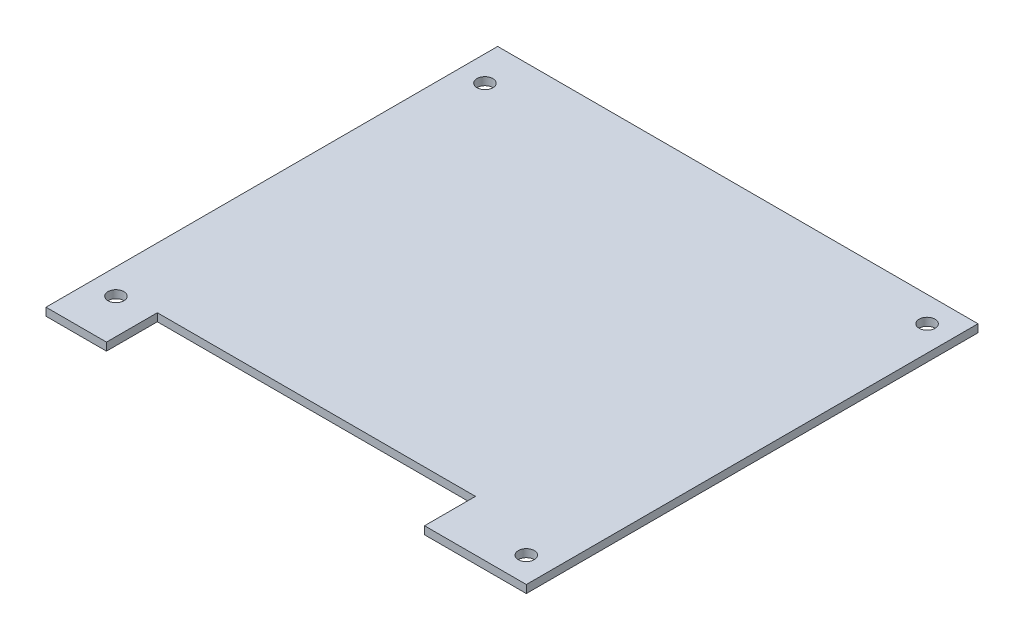
from build123d import *

# Parameters (mm, degrees)
BOSS_EXTRUDE1_DEPTH = 1.57
SKETCH2_R           = 1.59
CUT_EXTRUDE1_DEPTH  = 66.831946272


with BuildPart() as part:
    # Sketch1 → Boss-Extrude1 (new body)
    with BuildSketch(Plane(origin=(0, 0, 0), x_dir=(1, 0, 0), z_dir=(0, 1, 0))):
        Polygon((-35.875, -45.085), (-47.945, -45.085), (-47.945, 45.085), (47.945, 45.085), (47.945, -45.085), (27.625, -45.085), (27.625, -34.925), (-35.875, -34.925), align=None)
    extrude(amount=BOSS_EXTRUDE1_DEPTH)

    # Sketch2 → Cut-Extrude1 (cut, through all)
    with BuildSketch(Plane(origin=(0, 1.57, 0), x_dir=(1, 0, 0), z_dir=(0, 1, 0))):
        with Locations(Location((42.865, -40.005, 0), (0, 0, 270))):
            Circle(SKETCH2_R)
        with Locations(Location((-42.865, -36.195, 0), (0, 0, 270))):
            Circle(SKETCH2_R)
        with Locations(Location((-42.865, 37.465, 0), (0, 0, 270))):
            Circle(SKETCH2_R)
        with Locations(Location((42.865, 40.005, 0), (0, 0, 270))):
            Circle(SKETCH2_R)
    extrude(amount=-CUT_EXTRUDE1_DEPTH, mode=Mode.SUBTRACT)


solid = part.part
